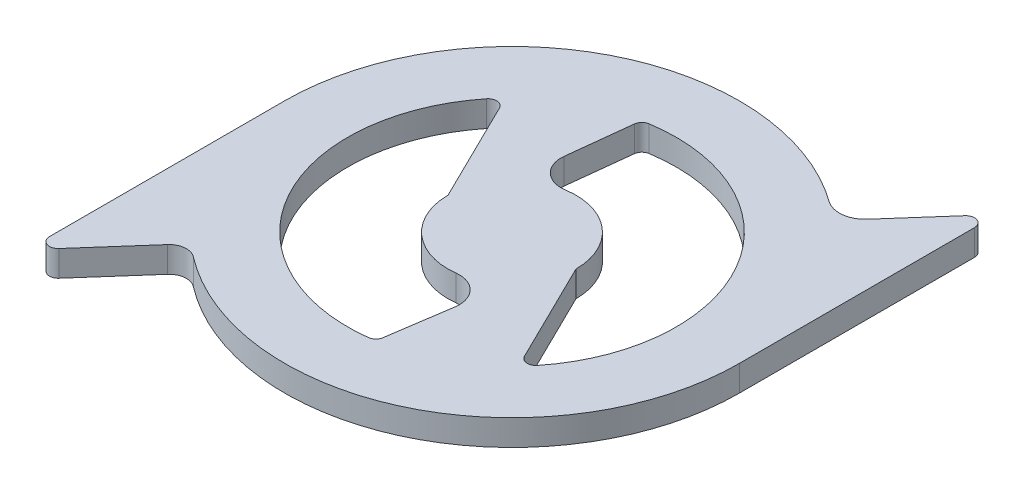
from build123d import *

# Parameters (mm, degrees)
RESSALTO_EXTRUS_O1_DEPTH = 3
FILETE2_R                = 1
FILETE3_R                = 1
FILETE4_R                = 3
FILETE5_R                = 1
FILETE6_R                = 2
FILETE8_R                = 3
FILETE9_R                = 1
FILETE10_R               = 1
FILETE11_R               = 1
FILETE12_R               = 3


with BuildPart() as part:
    # Esboço1 → Ressalto-extrusão1 (new body)
    with BuildSketch(Plane(origin=(0, 0, 0), x_dir=(1, 0, 0), z_dir=(0, 1, 0))):
        with BuildLine():
            Line((-26.457513111, 0), (-26.457513111, -30))
            Line((-26.457513111, -30), (-17.5, -19.843134833))
            ThreePointArc((-17.5, -19.843134833), (10.885621722, -24.114378278), (26.457513111, 0))
            Line((26.457513111, 0), (26.457513111, 30))
            Line((26.457513111, 30), (17.5, 19.843134833))
            ThreePointArc((17.5, 19.843134833), (-10.885621722, 24.114378278), (-26.457513111, 0))
        make_face()
        with BuildLine():
            Line((5.009713089, -5.505167823), (3.030153969, -18.87502089))
            ThreePointArc((3.030153969, -18.87502089), (-16.899174829, -8.936785595), (-13.894779058, 13.129484439))
            Line((-13.894779058, 13.129484439), (-7.443392908, 0))
            ThreePointArc((-7.443392908, 0), (-3.009554378, -6.80783963), (5.009713089, -5.505167823))
        make_face(mode=Mode.SUBTRACT)
        with BuildLine():
            ThreePointArc((13.894779058, -13.129484439), (16.738722413, 9.233819289), (-3.694798692, 18.756244542))
            Line((-3.694798692, 18.756244542), (-5.200992817, 5.324825979))
            ThreePointArc((-5.200992817, 5.324825979), (2.888863526, 6.8599246), (7.443392908, 0))
            Line((7.443392908, 0), (13.894779058, -13.129484439))
        make_face(mode=Mode.SUBTRACT)
    extrude(amount=RESSALTO_EXTRUS_O1_DEPTH)

    # Filete2
    filete2_edges = [part.edges().sort_by_distance(p)[0] for p in [
        (26.457513111, 1.5, -30),
    ]]
    fillet(filete2_edges, radius=FILETE2_R)

    # Filete3
    filete3_edges = [part.edges().sort_by_distance(p)[0] for p in [
        (-26.457513111, 1.5, 30),
    ]]
    fillet(filete3_edges, radius=FILETE3_R)

    # Filete4
    filete4_edges = [part.edges().sort_by_distance(p)[0] for p in [
        (-5.200992817, 1.5, -5.324825979),
    ]]
    fillet(filete4_edges, radius=FILETE4_R)

    # Filete5
    filete5_edges = [part.edges().sort_by_distance(p)[0] for p in [
        (-3.694798692, 1.5, -18.756244542),
    ]]
    fillet(filete5_edges, radius=FILETE5_R)

    # Filete6
    filete6_edges = [part.edges().sort_by_distance(p)[0] for p in [
        (-17.5, 1.5, 19.843134833),
    ]]
    fillet(filete6_edges, radius=FILETE6_R)

    # Filete8
    filete8_edges = [part.edges().sort_by_distance(p)[0] for p in [
        (5.009713089, 1.5, 5.505167823),
    ]]
    fillet(filete8_edges, radius=FILETE8_R)

    # Filete9
    filete9_edges = [part.edges().sort_by_distance(p)[0] for p in [
        (3.030153969, 1.5, 18.87502089),
    ]]
    fillet(filete9_edges, radius=FILETE9_R)

    # Filete10
    filete10_edges = [part.edges().sort_by_distance(p)[0] for p in [
        (13.894779058, 1.5, 13.129484439),
    ]]
    fillet(filete10_edges, radius=FILETE10_R)

    # Filete11
    filete11_edges = [part.edges().sort_by_distance(p)[0] for p in [
        (-13.894779058, 1.5, -13.129484439),
    ]]
    fillet(filete11_edges, radius=FILETE11_R)

    # Filete12
    filete12_edges = [part.edges().sort_by_distance(p)[0] for p in [
        (17.5, 1.5, -19.843134833),
    ]]
    fillet(filete12_edges, radius=FILETE12_R)


solid = part.part
